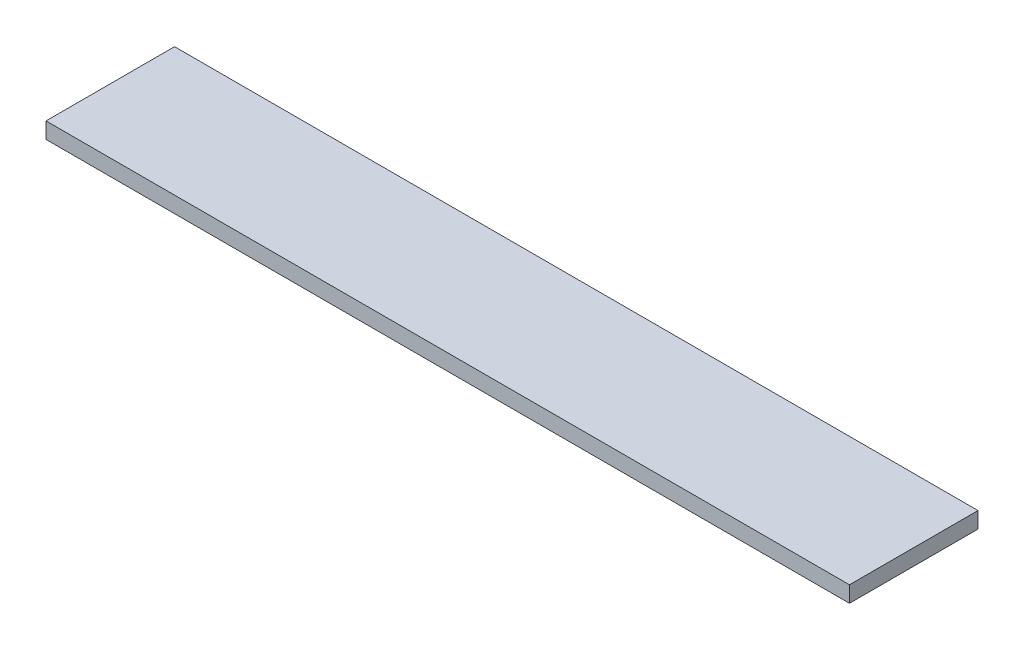
from build123d import *

# Parameters (mm, degrees)
SKETCH1_W           = 635
SKETCH1_H           = 101.6
BOSS_EXTRUDE1_DEPTH = 12.7


with BuildPart() as part:
    # Sketch1 → Boss-Extrude1 (new body)
    with BuildSketch(Plane(origin=(0, 0, 0), x_dir=(1, 0, 0), z_dir=(0, 1, 0))):
        Rectangle(SKETCH1_W, SKETCH1_H)
    extrude(amount=BOSS_EXTRUDE1_DEPTH)


solid = part.part
